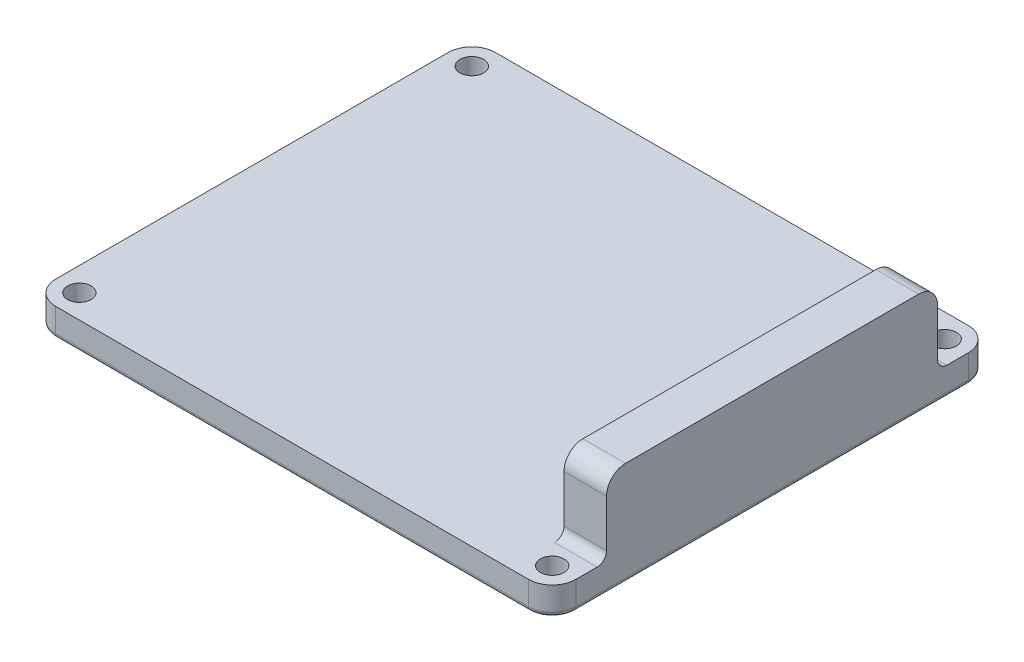
from build123d import *

# Parameters (mm, degrees)
SKETCH1_R           = 1.25
BOSS_EXTRUDE1_DEPTH = 3
SKETCH2_W           = 4.5
SKETCH2_H           = 35
BOSS_EXTRUDE2_DEPTH = 8
FILLET1_R           = 1
FILLET2_R           = 2
FILLET3_R           = 0.5


with BuildPart() as part:
    # Sketch1 → Boss-Extrude1 (new body)
    with BuildSketch(Plane(origin=(0, 0, 0), x_dir=(1, 0, 0), z_dir=(0, 1, 0))):
        with BuildLine():
            Line((-27.5, -19.25), (-27.5, -20.75))
            ThreePointArc((-27.5, -20.75), (-26.767766953, -22.517766953), (-25, -23.25))
            Line((-25, -23.25), (25, -23.25))
            ThreePointArc((25, -23.25), (26.767766953, -22.517766953), (27.5, -20.75))
            Line((27.5, -20.75), (27.5, 20.75))
            ThreePointArc((27.5, 20.75), (26.767766953, 22.517766953), (25, 23.25))
            Line((25, 23.25), (-25, 23.25))
            ThreePointArc((-25, 23.25), (-26.767766953, 22.517766953), (-27.5, 20.75))
            Line((-27.5, 20.75), (-27.5, 19.25))
            Line((-27.5, 19.25), (-27.5, -19.25))
        make_face()
        with Locations(Location((-25, -20.75, 0), (0, 0, 270))):
            Circle(SKETCH1_R, mode=Mode.SUBTRACT)
        with Locations(Location((25, -20.75, 0), (0, 0, 270))):
            Circle(SKETCH1_R, mode=Mode.SUBTRACT)
        with Locations(Location((25, 20.75, 0), (0, 0, 270))):
            Circle(SKETCH1_R, mode=Mode.SUBTRACT)
        with Locations(Location((-25, 20.75, 0), (0, 0, 270))):
            Circle(SKETCH1_R, mode=Mode.SUBTRACT)
    extrude(amount=BOSS_EXTRUDE1_DEPTH)

    # Sketch2 → Boss-Extrude2 (add)
    with BuildSketch(Plane(origin=(0, 3, 0), x_dir=(1, 0, 0), z_dir=(0, 1, 0))):
        with Locations((25.25, 0)):
            Rectangle(SKETCH2_W, SKETCH2_H)
    extrude(amount=BOSS_EXTRUDE2_DEPTH)

    # Fillet1
    fillet1_edges = [part.edges().sort_by_distance(p)[0] for p in [
        (25.25, 3, -17.5),
        (25.25, 3, 17.5),
    ]]
    fillet(fillet1_edges, radius=FILLET1_R)

    # Fillet2
    fillet2_edges = [part.edges().sort_by_distance(p)[0] for p in [
        (25.25, 11, -17.5),
        (25.25, 11, 17.5),
    ]]
    fillet(fillet2_edges, radius=FILLET2_R)

    # Fillet3
    fillet3_edges = [part.edges().sort_by_distance(p)[0] for p in [
        (-27.5, 0, 0),
        (-26.767766953, 0, -22.517766953),
        (0, 0, -23.25),
        (26.767766953, 0, -22.517766953),
        (27.5, 0, 0),
        (26.767766953, 0, 22.517766953),
        (0, 0, 23.25),
        (-26.767766953, 0, 22.517766953),
        (-25, 0, 19.5),
        (25, 0, 19.5),
        (25, 0, -22),
        (-25, 0, -22),
    ]]
    fillet(fillet3_edges, radius=FILLET3_R)


solid = part.part
